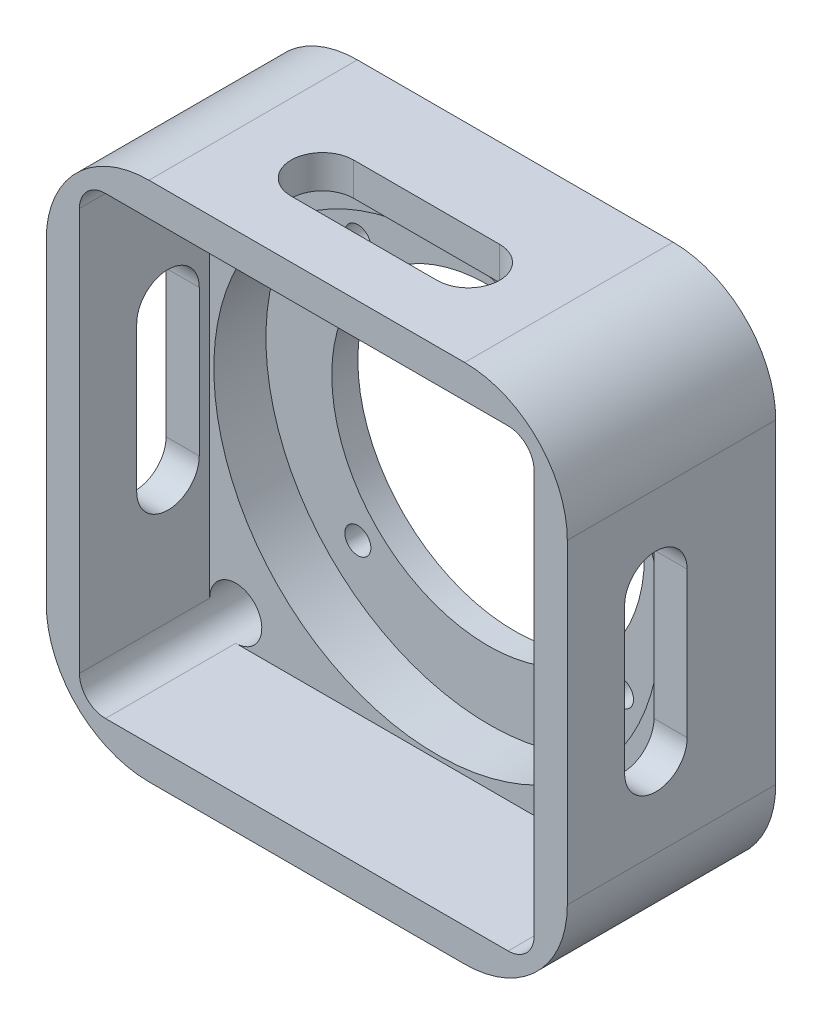
from build123d import *

# Parameters (mm, degrees)
SKETCH_1_R          = 5
SKETCH_1_R_2        = 42.84145639
EXTRUDE_2_DEPTH     = 40
SKETCH_1_5_R        = 42.84145639
EXTRUDE_3_DEPTH     = 5
CUT_EXTRUDE_START   = 25
CUT_EXTRUDE_2_DEPTH = 25
SKETCH_5_R          = 30
SKETCH_5_R_2        = 2.5
CUT_EXTRUDE_3_DEPTH = 82.240384046
CUT_EXTRUDE_4_DEPTH = 10


with BuildPart() as part:
    # 草图1 → 凸台-拉伸2 (new body)
    with BuildSketch(Plane.XY):
        with BuildLine():
            Line((-30.293484329, 50), (30.293484329, 50))
            ThreePointArc((30.293484329, 50), (44.228095194, 44.228095194), (50, 30.293484329))
            Line((50, 30.293484329), (50, -30.293484329))
            ThreePointArc((50, -30.293484329), (44.228095194, -44.228095194), (30.293484329, -50))
            Line((30.293484329, -50), (-30.293484329, -50))
            ThreePointArc((-30.293484329, -50), (-44.228095194, -44.228095194), (-50, -30.293484329))
            Line((-50, -30.293484329), (-50, 30.293484329))
            ThreePointArc((-50, 30.293484329), (-44.228095194, 44.228095194), (-30.293484329, 50))
        make_face()
        with Locations((-38.635004029, 38.635004029)):
            Circle(SKETCH_1_R, mode=Mode.SUBTRACT)
        with Locations((38.635004029, 38.635004029)):
            Circle(SKETCH_1_R, mode=Mode.SUBTRACT)
        with Locations((38.635004029, -38.635004029)):
            Circle(SKETCH_1_R, mode=Mode.SUBTRACT)
        with Locations((-38.635004029, -38.635004029)):
            Circle(SKETCH_1_R, mode=Mode.SUBTRACT)
        Circle(SKETCH_1_R_2, mode=Mode.SUBTRACT)
    extrude(amount=EXTRUDE_2_DEPTH)

    # 草图1<5> → 凸台-拉伸3 (add)
    with BuildSketch(Plane.XY):
        Circle(SKETCH_1_5_R)
    extrude(amount=EXTRUDE_3_DEPTH)

    # 草图4 → 切除-拉伸2 (cut)
    with BuildSketch(Plane(origin=(0, 0, 40), x_dir=(-1, 0, 0), z_dir=(0, 0, -1)).offset(CUT_EXTRUDE_START)):
        with BuildLine():
            Line((-38.635004029, 43.635004029), (38.635004029, 43.635004029))
            ThreePointArc((38.635004029, 43.635004029), (42.170537935, 42.170537935), (43.635004029, 38.635004029))
            Line((43.635004029, 38.635004029), (43.635004029, -38.635004029))
            ThreePointArc((43.635004029, -38.635004029), (42.170537935, -42.170537935), (38.635004029, -43.635004029))
            Line((38.635004029, -43.635004029), (-38.635004029, -43.635004029))
            ThreePointArc((-38.635004029, -43.635004029), (-42.170537935, -42.170537935), (-43.635004029, -38.635004029))
            Line((-43.635004029, -38.635004029), (-43.635004029, 38.635004029))
            ThreePointArc((-43.635004029, 38.635004029), (-42.170537935, 42.170537935), (-38.635004029, 43.635004029))
        make_face()
    extrude(amount=-CUT_EXTRUDE_2_DEPTH, mode=Mode.SUBTRACT)

    # 草图5 → 切除-拉伸3 (cut, through all)
    with BuildSketch(Plane(origin=(0, 0, 0), x_dir=(-1, 0, 0), z_dir=(0, 0, -1))):
        with Locations((0.201090543, 0.15997854)):
            Circle(SKETCH_5_R)
        with Locations((-24.798909457, 25.15997854)):
            Circle(SKETCH_5_R_2)
        with Locations((25.201090543, 25.15997854)):
            Circle(SKETCH_5_R_2)
        with Locations((25.201090543, -24.84002146)):
            Circle(SKETCH_5_R_2)
        with Locations((-25.201090543, -24.84002146)):
            Circle(SKETCH_5_R_2)
    extrude(amount=-CUT_EXTRUDE_3_DEPTH, mode=Mode.SUBTRACT)

    # 草图7 → 切除-拉伸4 (cut)
    with BuildSketch(Plane.ZY.offset(50)):
        with BuildLine():
            Line((29, 14), (29, -14))
            ThreePointArc((29, -14), (23, -20), (17, -14))
            Line((17, -14), (17, 14))
            ThreePointArc((17, 14), (23, 20), (29, 14))
        make_face()
    cut_extrude_4 = extrude(amount=-CUT_EXTRUDE_4_DEPTH, mode=Mode.SUBTRACT)

    # 镜向1: 切除-拉伸4 across plane
    add(cut_extrude_4.mirror(Plane(origin=(0, 0, 0), x_dir=(0, 0, 1), z_dir=(1, 0, 0))), mode=Mode.SUBTRACT)

    # 镜向2: 切除-拉伸4 across plane
    add(cut_extrude_4.mirror(Plane(origin=(0, 0, 0), x_dir=(0, 0, 1), z_dir=(0.7071067811865475, 0.7071067811865477, 0))), mode=Mode.SUBTRACT)


solid = part.part
